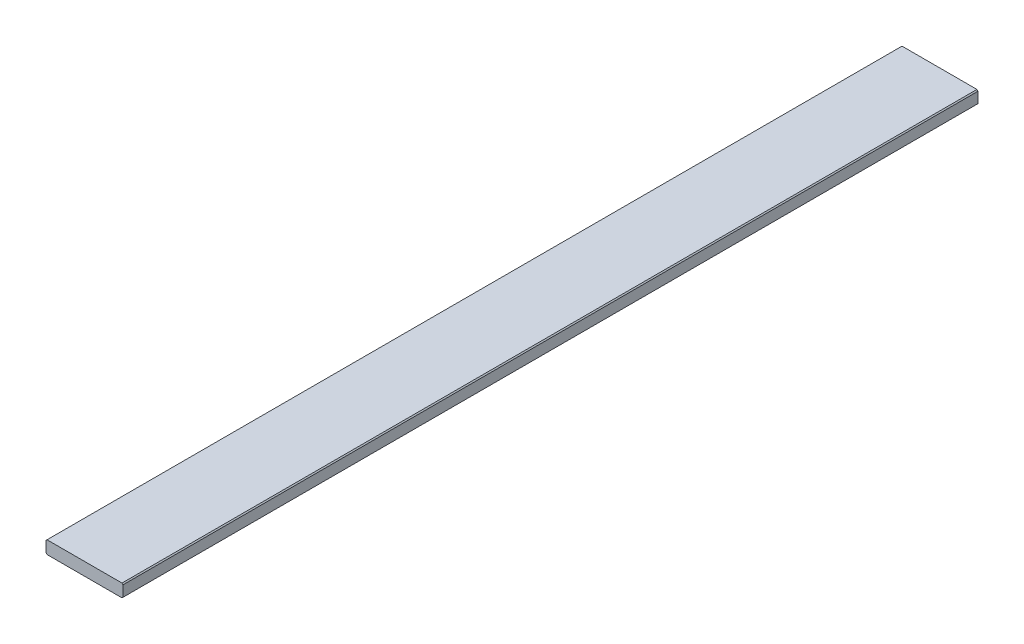
from build123d import *

# Parameters (mm, degrees)
EXTRUDE_1_DEPTH = 1665


with BuildPart() as part:
    # Эскиз1 → Бобышка-Вытянуть1 (new body)
    with BuildSketch(Plane.XY):
        Polygon((-75, 10.5), (-73, 12.5), (73, 12.5), (75, 10.5), (75, -10.5), (73, -12.5), (-73, -12.5), (-75, -10.5), align=None)
    extrude(amount=EXTRUDE_1_DEPTH)


solid = part.part
